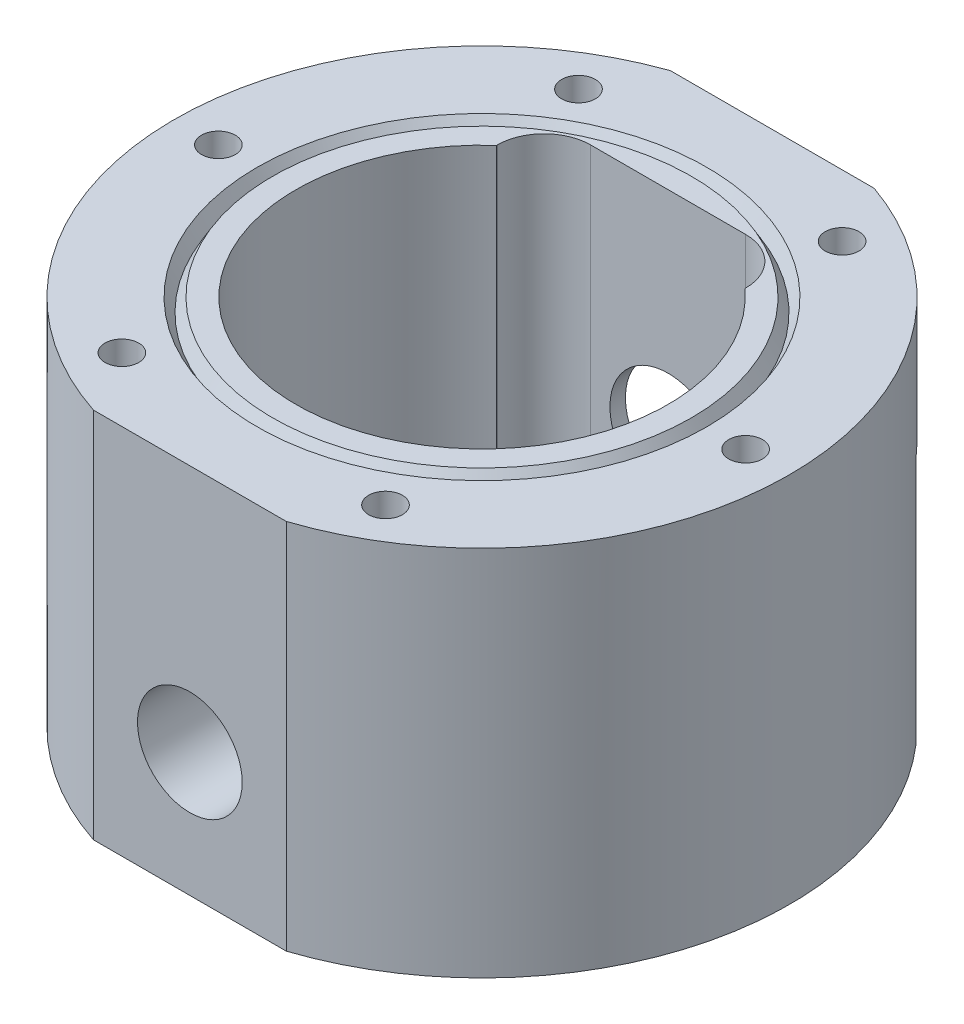
from build123d import *

# Parameters (mm, degrees)
CUT_EXTRUDE1_DEPTH          = 59.614042959
CIRPATTERN1_COUNT           = 6
SKETCH11_R                  = 5.953125
CUT_EXTRUDE3_DEPTH          = 59.614042959
F_4_40_TAPPED_HOLE2_D       = 2.2606
CUT_EXTRUDE4_DEPTH          = 59.614042959
F_1_2_13_TAPPED_HOLE1_D     = 10.71626
F_1_2_13_TAPPED_HOLE1_DEPTH = 28.829
F_1_2_13_TAPPED_HOLE1_TIP   = 3.219489309
CUT_EXTRUDE5_REACH          = 79.453
CUT_EXTRUDE5_END_RADIUS     = 19.05
SKETCH23_R                  = 5.953125
CUT_EXTRUDE6_REACH          = 59.777
SKETCH25_W                  = 87.993587341
SKETCH25_H                  = 27.156858223
CUT_EXTRUDE7_DEPTH          = 9.0805


with BuildPart() as part:
    # Sketch1 → Revolve1 (revolve)
    with BuildSketch(Plane.XY):
        Polygon((19.05, 0), (19.05, -31.75), (0, -31.75), (0, -38.1), (31.496, -38.1), (31.496, 0), (23.01875, 0), (22.225, -1.374815329), (21.43125, 0), align=None)
    revolve(axis=Axis((0, -582.039095303, 0), (0, 1, 0)))

    # Sketch2 → Cut-Extrude1 (cut, through all)
    with BuildSketch(Plane(origin=(0, 0, 0), x_dir=(1, 0, 0), z_dir=(0, 1, 0))):
        with BuildLine():
            Line((-10.432568811, 29.718), (10.432568811, 29.718))
            ThreePointArc((10.432568811, 29.718), (0, 31.496), (-10.432568811, 29.718))
        make_face()
    extrude(amount=-CUT_EXTRUDE1_DEPTH, mode=Mode.SUBTRACT)

    # Sketch5 → #8-32 Tapped Hole1 (revolve, cut)
    with BuildSketch(Plane(origin=(-13.49375, 0, -23.371860585), x_dir=(0, 0, 1), z_dir=(1, 0, 0))):
        Polygon((0, 0), (0, 18.208206461), (1.7272, 17.1704), (1.7272, 0), align=None)
    f_8_32_tapped_hole1 = revolve(axis=Axis((-13.49375, 6.35, -23.371860585), (0, -1, 0)), mode=Mode.SUBTRACT)

    # CirPattern1: #8-32 Tapped Hole1 ×6 about axis
    cirpattern1_axis = Axis((0, 0, 0), (0, 1, 0))
    for i in range(1, CIRPATTERN1_COUNT):
        add(f_8_32_tapped_hole1.rotate(cirpattern1_axis, i * 360 / CIRPATTERN1_COUNT), mode=Mode.SUBTRACT)

    # Sketch11 → Cut-Extrude3 (cut, through all)
    with BuildSketch(Plane.XZ.offset(38.1)):
        Circle(SKETCH11_R)
    extrude(amount=-CUT_EXTRUDE3_DEPTH, mode=Mode.SUBTRACT)

    # #4-40 Tapped Hole2 (through all)
    with Locations(Plane(origin=(0, -38.1, 0), x_dir=(-1, 0, 0), z_dir=(0, -1, 0))):
        with Locations((6.35, -6.35), (-6.35, -6.35), (-6.35, 6.35), (6.35, 6.35)):
            Hole(F_4_40_TAPPED_HOLE2_D / 2)

    # Sketch16 → Cut-Extrude4 (cut, through all)
    with BuildSketch(Plane.XZ.offset(38.1)):
        with BuildLine():
            Line((-9.873177996, 29.9085), (9.873177996, 29.9085))
            ThreePointArc((9.873177996, 29.9085), (0, 31.496), (-9.873177996, 29.9085))
        make_face()
    extrude(amount=-CUT_EXTRUDE4_DEPTH, mode=Mode.SUBTRACT)

    # 1/2-13 Tapped Hole1
    with Locations(Plane.XY.offset(29.9085)):
        with Locations((0, -25.4)):
            Hole(F_1_2_13_TAPPED_HOLE1_D / 2, depth=F_1_2_13_TAPPED_HOLE1_DEPTH)
            with Locations((0, 0, -(F_1_2_13_TAPPED_HOLE1_DEPTH + F_1_2_13_TAPPED_HOLE1_TIP / 2))):  # 118° drill point
                Cone(0, F_1_2_13_TAPPED_HOLE1_D / 2, F_1_2_13_TAPPED_HOLE1_TIP, mode=Mode.SUBTRACT)

    # Cut-Extrude5: up to this cylinder (the profile starts outside it)
    cut_extrude5_end = Plane(origin=(0, -22.225, 0), z_dir=(0, -1, 0)) * Cylinder(CUT_EXTRUDE5_END_RADIUS, 198.006, mode=Mode.PRIVATE)
    # Sketch23 → Cut-Extrude5 (cut, up to the surface)
    with BuildSketch(Plane(origin=(0, 0, -29.718), x_dir=(-1, 0, 0), z_dir=(0, 0, -1)), mode=Mode.PRIVATE) as cut_extrude5_sk1:
        with Locations((0, -22.225)):
            Circle(SKETCH23_R)
    cut_extrude5_tool1 = extrude(cut_extrude5_sk1.sketch, amount=-CUT_EXTRUDE5_REACH, mode=Mode.PRIVATE) - cut_extrude5_end
    add(cut_extrude5_tool1.solids().sort_by_distance((0, -22.225, -29.718))[0], mode=Mode.SUBTRACT)

    # Cut-Extrude6: up to this face of the body (flat: up to its plane)
    cut_extrude6_end = Plane(part.part.faces().sort_by_distance((-18.511184633, -31.75, 0))[0])
    # Sketch24 → Cut-Extrude6 (cut, up to the picked face)
    with BuildSketch(Plane(origin=(0, 0, 0), x_dir=(1, 0, 0), z_dir=(0, 1, 0)), mode=Mode.PRIVATE) as cut_extrude6_sk1:
        with BuildLine():
            Line((-7.9375, 19.05), (7.9375, 19.05))
            ThreePointArc((7.9375, 19.05), (11.305096045, 17.655096045), (12.7, 14.2875))
            Line((12.7, 14.2875), (12.7, 5.742929028))
            Line((12.7, 5.742929028), (-12.7, 5.742929028))
            Line((-12.7, 5.742929028), (-12.7, 14.2875))
            ThreePointArc((-12.7, 14.2875), (-11.305096045, 17.655096045), (-7.9375, 19.05))
        make_face()
    cut_extrude6_tool1 = split(extrude(cut_extrude6_sk1.sketch, amount=-CUT_EXTRUDE6_REACH, mode=Mode.PRIVATE), bisect_by=cut_extrude6_end, keep=Keep.BOTH, mode=Mode.PRIVATE)
    add(cut_extrude6_tool1.solids().sort_by(Axis((0, 0, -12.230696), (0, -1, 0)))[0], mode=Mode.SUBTRACT)

    # Sketch25 → Cut-Extrude7 (cut)
    with BuildSketch(Plane(origin=(0, 0, -29.718), x_dir=(-1, 0, 0), z_dir=(0, 0, -1))):
        with Locations((-3.719611081, -26.278429112)):
            Rectangle(SKETCH25_W, SKETCH25_H)
    extrude(amount=-CUT_EXTRUDE7_DEPTH, mode=Mode.SUBTRACT)


solid = part.part
